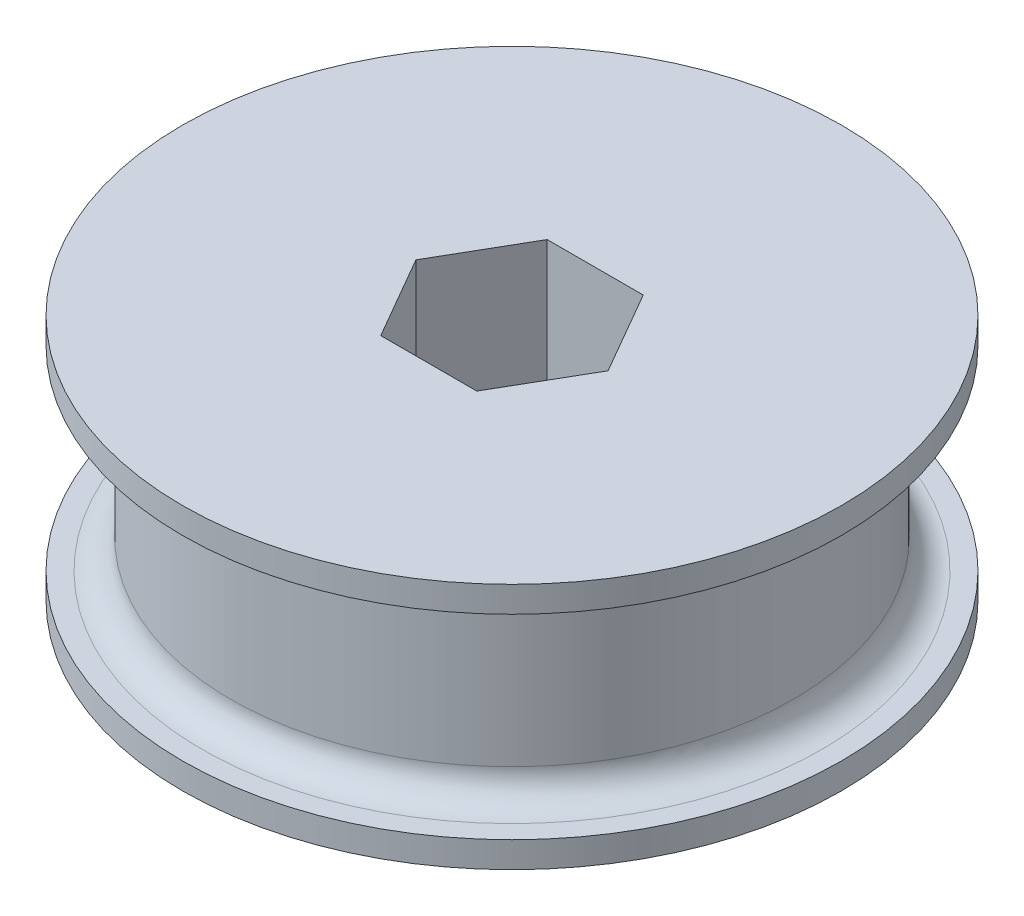
from build123d import *

# Parameters (mm, degrees)
SKETCH1_R           = 25.4
SKETCH1_R_2         = 4.8387
BOSS_EXTRUDE1_DEPTH = 19.05
CUT_EXTRUDE1_DEPTH  = 41.659838908


with BuildPart() as part:
    # Sketch1 → Boss-Extrude1 (new body)
    with BuildSketch(Plane(origin=(0, 0, 0), x_dir=(1, 0, 0), z_dir=(0, 1, 0))):
        with Locations(Location((0, 0, 0), (0, 0, 90))):
            Circle(SKETCH1_R)
        with Locations(Location((0, 0, 0), (0, 0, 90))):
            Circle(SKETCH1_R_2, mode=Mode.SUBTRACT)
    extrude(amount=BOSS_EXTRUDE1_DEPTH)

    # Sketch6 → Cut-Extrude1 (cut, through all)
    with BuildSketch(Plane(origin=(0, 19.05, 0), x_dir=(1, 0, 0), z_dir=(0, 1, 0))):
        Polygon((3.702835951, -6.4135), (7.405671903, 0), (3.702835951, 6.4135), (-3.702835951, 6.4135), (-7.405671903, 0), (-3.702835951, -6.4135), align=None)
    extrude(amount=-CUT_EXTRUDE1_DEPTH, mode=Mode.SUBTRACT)

    # Sketch2 → Cut-Revolve1 (revolve, cut)
    with BuildSketch(Plane.XY, mode=Mode.PRIVATE) as cut_revolve1_sk:
        with BuildLine():
            Line((25.4, 17.04975), (23.876, 17.04975))
            ThreePointArc((23.876, 17.04975), (22.304455179, 16.398794821), (21.6535, 14.82725))
            Line((21.6535, 14.82725), (21.6535, 4.22275))
            ThreePointArc((21.6535, 4.22275), (22.304455179, 2.651205179), (23.876, 2.00025))
            Line((23.876, 2.00025), (25.4, 2.00025))
            Line((25.4, 2.00025), (25.4, 17.04975))
        make_face()
    revolve(cut_revolve1_sk.sketch.rotate(Axis((0, 0, 0), (0, 1, 0)), 90), axis=Axis((0, 0, 0), (0, 1, 0)), mode=Mode.SUBTRACT)


solid = part.part
